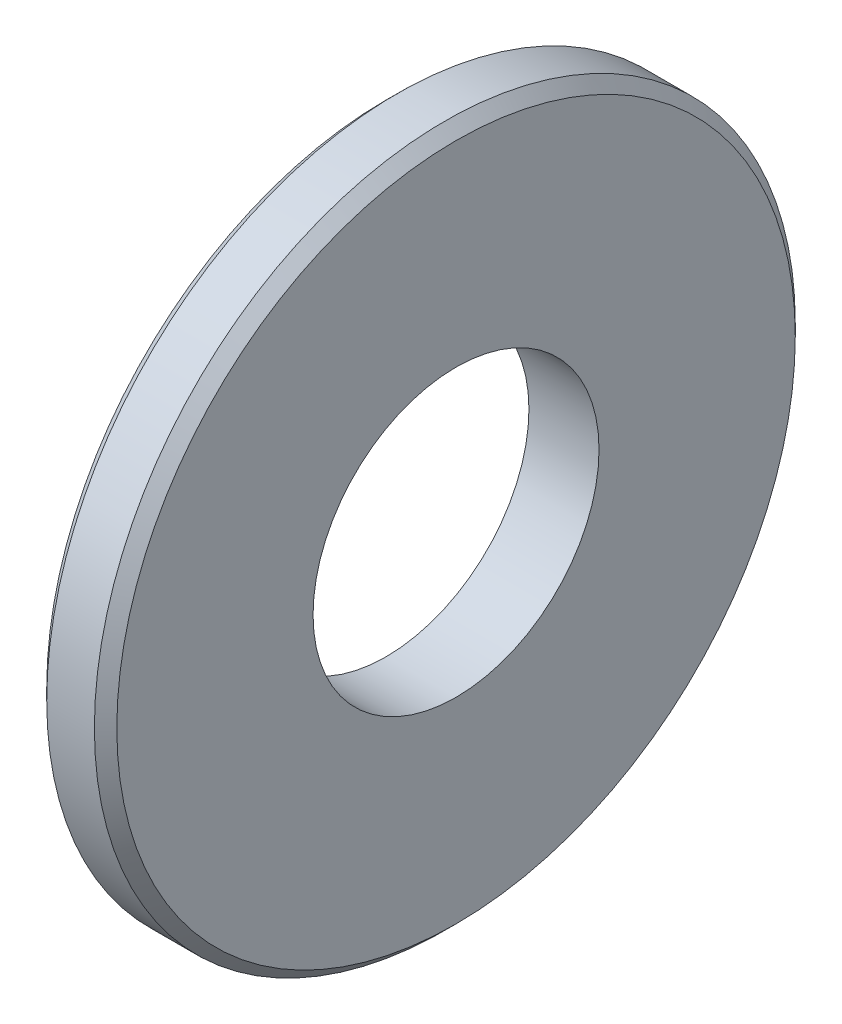
from build123d import *

# Parameters (mm, degrees)
SKETCH1_R           = 7.9375
SKETCH1_R_2         = 3.2385
BOSS_EXTRUDE1_DEPTH = 1.5875
CHAMFER1_SIZE       = 0.254


with BuildPart() as part:
    # Sketch1 → Boss-Extrude1 (new body)
    with BuildSketch(Plane(origin=(0, 0, 0), x_dir=(0, 0, -1), z_dir=(1, 0, 0))):
        Circle(SKETCH1_R)
        Circle(SKETCH1_R_2, mode=Mode.SUBTRACT)
    extrude(amount=BOSS_EXTRUDE1_DEPTH)

    # Chamfer1
    chamfer1_edges = [part.edges().sort_by_distance(p)[0] for p in [
        (0, 0, 7.9375),
        (1.5875, 0, 7.9375),
    ]]
    chamfer(chamfer1_edges, length=CHAMFER1_SIZE)


solid = part.part
